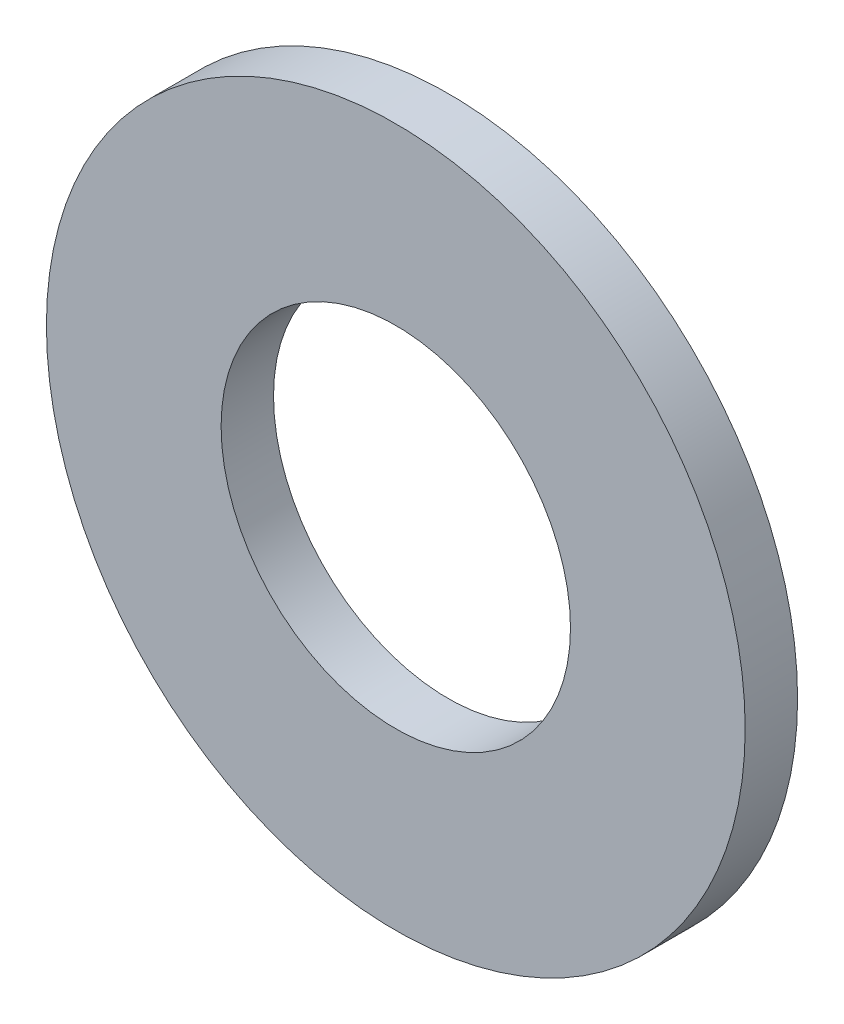
from build123d import *

# Parameters (mm, degrees)
SKETCH_1_R      = 2
SKETCH_1_R_2    = 1
EXTRUDE_1_DEPTH = 0.15


with BuildPart() as part:
    # 草图1 → 凸台-拉伸1 (new, symmetric)
    with BuildSketch(Plane.XY):
        Circle(SKETCH_1_R)
        Circle(SKETCH_1_R_2, mode=Mode.SUBTRACT)
    extrude(amount=EXTRUDE_1_DEPTH, both=True)


solid = part.part
